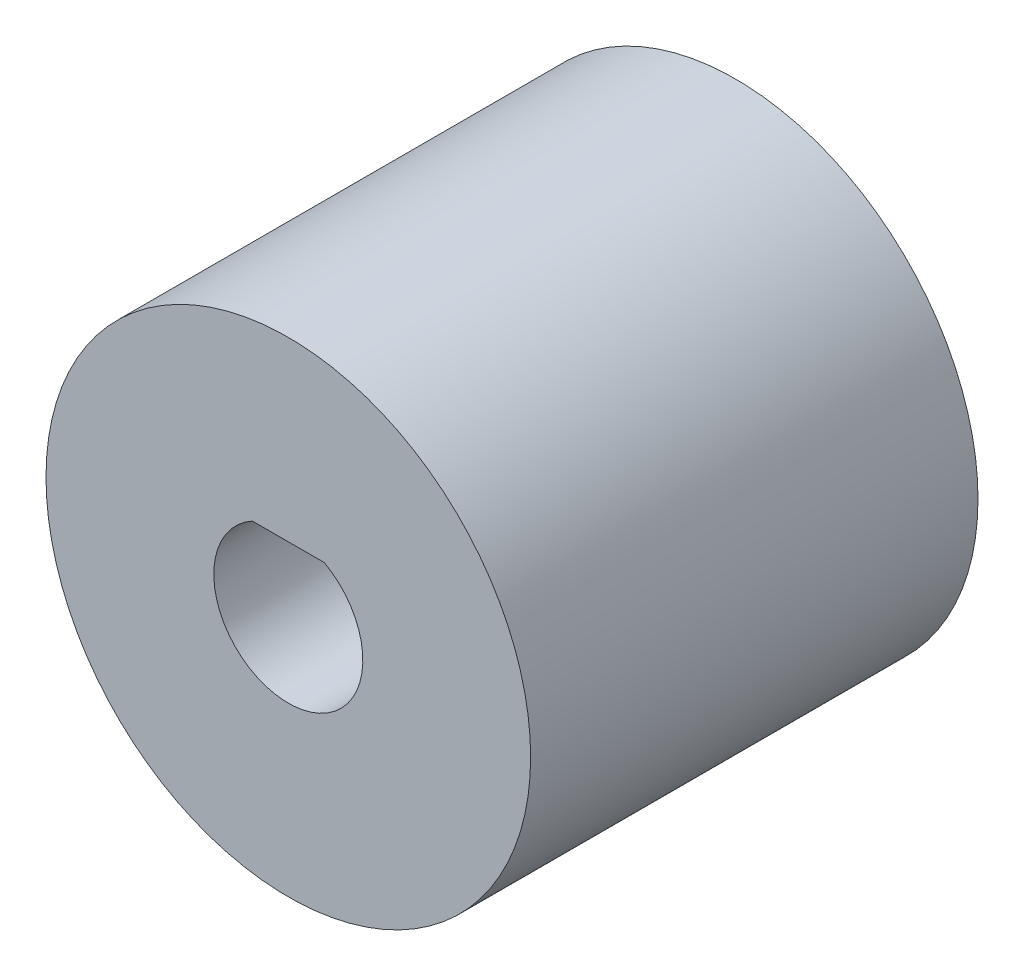
from build123d import *

# Parameters (mm, degrees)
SKETCH3_R           = 13
BOSS_EXTRUDE1_DEPTH = 24


with BuildPart() as part:
    # Sketch3 → Boss-Extrude1 (new body)
    with BuildSketch(Plane.XY):
        Circle(SKETCH3_R)
        with BuildLine():
            Line((1.93132241, 3.5), (-1.93132241, 3.5))
            ThreePointArc((-1.93132241, 3.5), (0, -3.9975), (1.93132241, 3.5))
        make_face(mode=Mode.SUBTRACT)
    extrude(amount=-BOSS_EXTRUDE1_DEPTH)


solid = part.part
